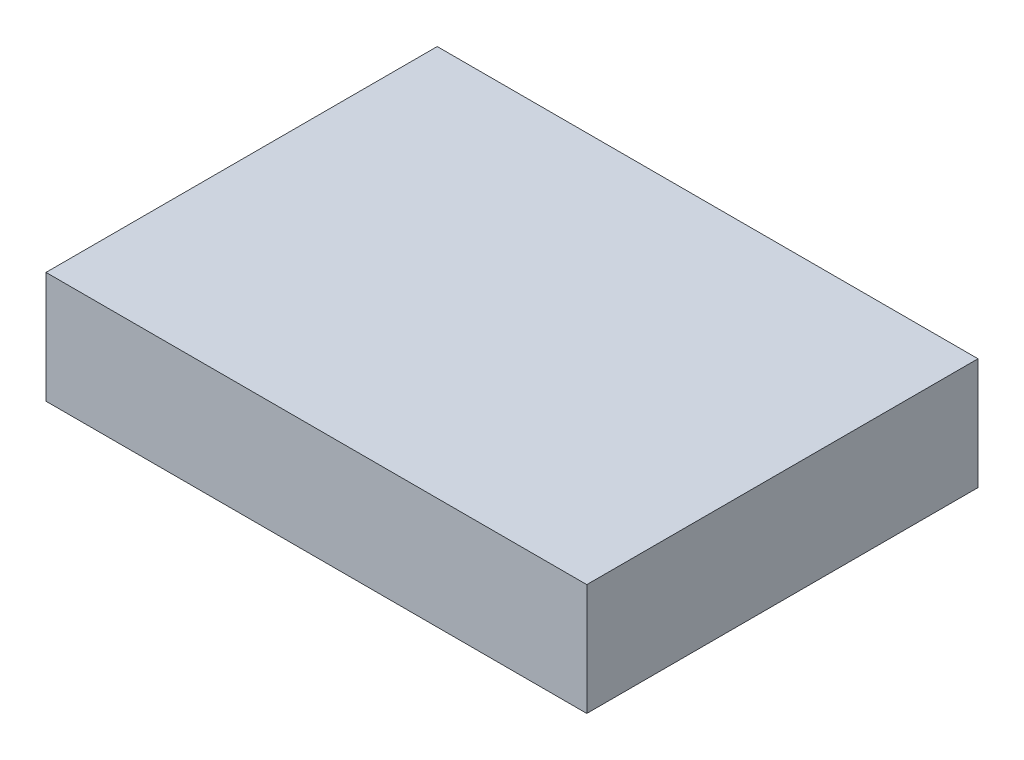
from build123d import *

# Parameters (mm, degrees)
ESBO_O1_W                = 48.457785267
ESBO_O1_H                = 35.054568065
RESSALTO_EXTRUS_O1_DEPTH = 10


with BuildPart() as part:
    # Esboço1 → Ressalto-extrusão1 (new body)
    with BuildSketch(Plane(origin=(0, 0, 0), x_dir=(1, 0, 0), z_dir=(0, 1, 0))):
        with Locations((-6.959362778, 2.062033416)):
            Rectangle(ESBO_O1_W, ESBO_O1_H)
    extrude(amount=RESSALTO_EXTRUS_O1_DEPTH)


solid = part.part
